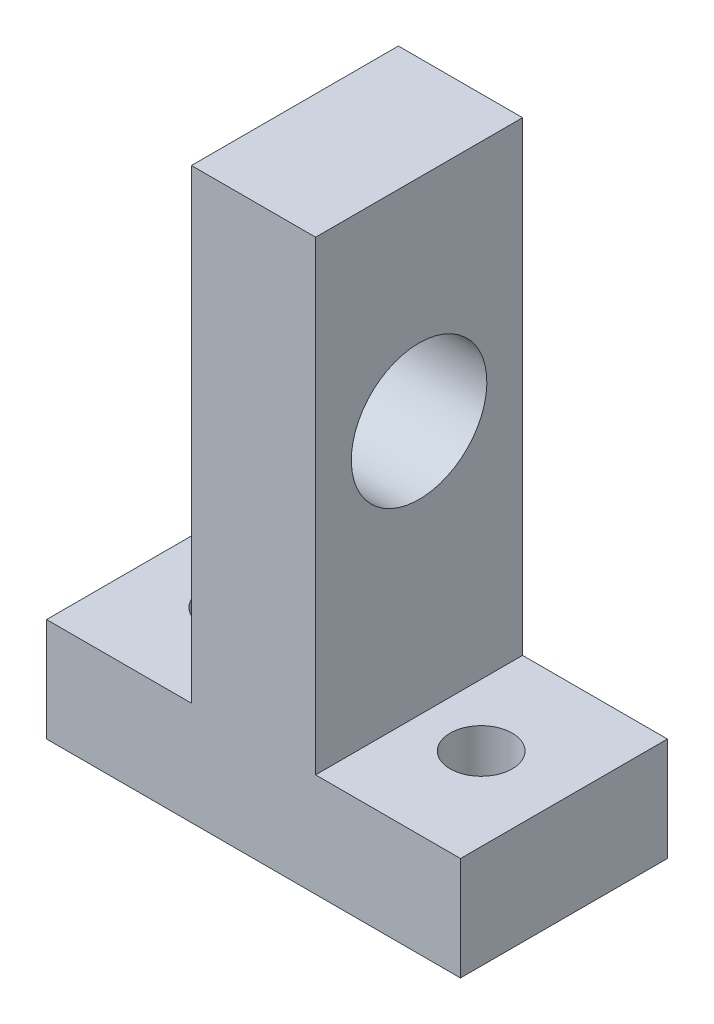
from build123d import *

# Parameters (mm, degrees)
SALIENTE_EXTRUIR1_DEPTH = 5
CROQUIS4_R              = 3.275
CORTAR_EXTRUIR3_DEPTH   = 15
CROQUIS5_R              = 1.5
CORTAR_EXTRUIR4_DEPTH   = 10


with BuildPart() as part:
    # Croquis1 → Saliente-Extruir1 (new, symmetric)
    with BuildSketch(Plane.XY):
        Polygon((3, -8.75), (3, 13.75), (0, 13.75), (0, -13.75), (10, -13.75), (10, -8.75), align=None)
        Polygon((0, -13.75), (0, 13.75), (-3, 13.75), (-3, -8.75), (-10, -8.75), (-10, -13.75), align=None)
    extrude(amount=SALIENTE_EXTRUIR1_DEPTH, both=True)

    # Croquis4 → Cortar-Extruir3 (cut)
    with BuildSketch(Plane(origin=(3, 0, 0), x_dir=(0, 0, -1), z_dir=(1, 0, 0))):
        with Locations(Location((0, 3.55, 0), (0, 0, 90))):
            Circle(CROQUIS4_R)
    extrude(amount=-CORTAR_EXTRUIR3_DEPTH, mode=Mode.SUBTRACT)

    # Croquis5 → Cortar-Extruir4 (cut)
    with BuildSketch(Plane.XZ.offset(13.75)):
        with Locations((-6, 0)):
            Circle(CROQUIS5_R)
        with Locations(Location((6, 0, 0), (0, 0, 180))):
            Circle(CROQUIS5_R)
    extrude(amount=-CORTAR_EXTRUIR4_DEPTH, mode=Mode.SUBTRACT)


solid = part.part
